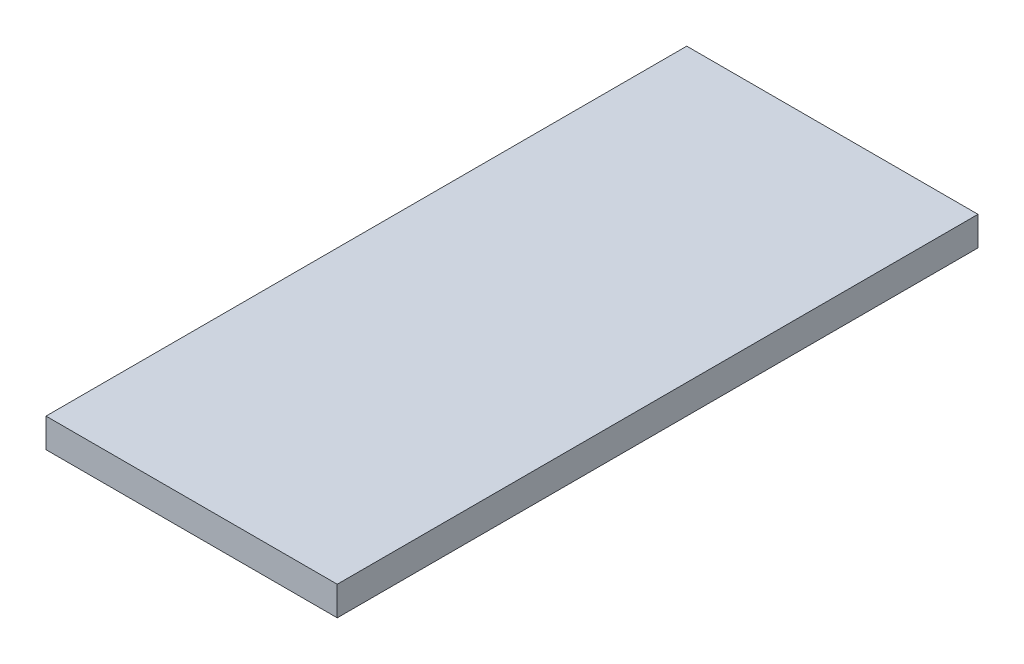
from build123d import *

# Parameters (mm, degrees)
SKETCH1_W           = 10
SKETCH1_H           = 22
BOSS_EXTRUDE1_DEPTH = 1


with BuildPart() as part:
    # Sketch1 → Boss-Extrude1 (new body)
    with BuildSketch(Plane(origin=(0, 0, 0), x_dir=(1, 0, 0), z_dir=(0, 1, 0))):
        with Locations((5, -11)):
            Rectangle(SKETCH1_W, SKETCH1_H)
    extrude(amount=BOSS_EXTRUDE1_DEPTH)


solid = part.part
